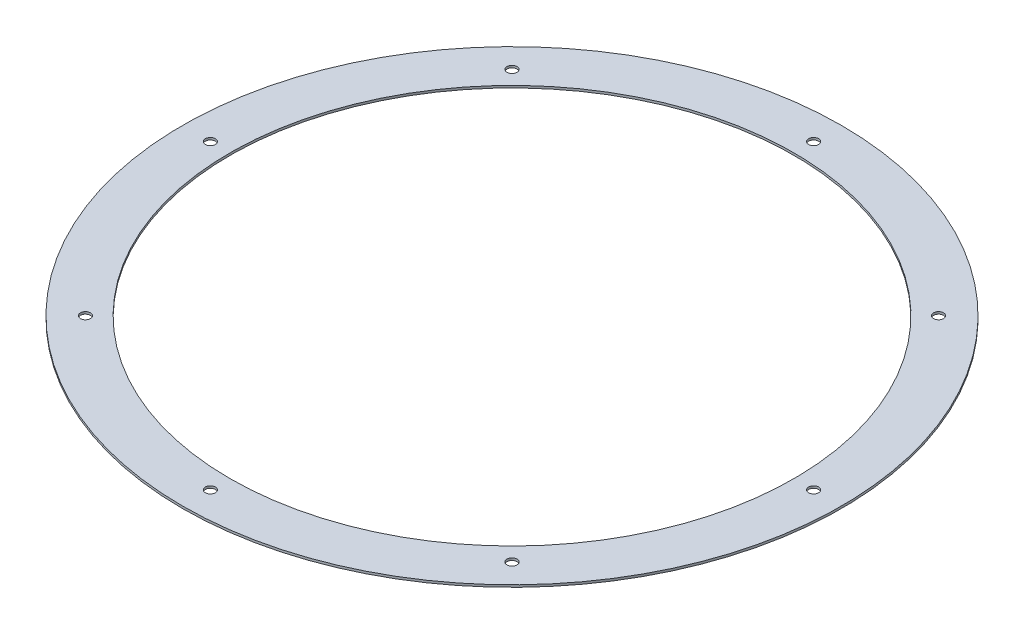
from build123d import *

# Parameters (mm, degrees)
SKETCH1_R           = 295
SKETCH1_R_2         = 252.5
BOSS_EXTRUDE1_DEPTH = 2
SKETCH2_R           = 4.5
CUT_EXTRUDE1_DEPTH  = 2
CIRPATTERN1_COUNT   = 8


with BuildPart() as part:
    # Sketch1 → Boss-Extrude1 (new body)
    with BuildSketch(Plane(origin=(0, 0, 0), x_dir=(1, 0, 0), z_dir=(0, 1, 0))):
        with Locations(Location((0, 0, 0), (0, 0, 270))):
            Circle(SKETCH1_R)
        with Locations(Location((0, 0, 0), (0, 0, 270))):
            Circle(SKETCH1_R_2, mode=Mode.SUBTRACT)
    extrude(amount=BOSS_EXTRUDE1_DEPTH)

    # Sketch2 → Cut-Extrude1 (cut)
    with BuildSketch(Plane(origin=(0, 2, 0), x_dir=(1, 0, 0), z_dir=(0, 1, 0))):
        with Locations(Location((0, 270, 0), (0, 0, 270))):
            Circle(SKETCH2_R)
    cut_extrude1 = extrude(amount=-CUT_EXTRUDE1_DEPTH, mode=Mode.SUBTRACT)

    # CirPattern1: Cut-Extrude1 ×8 about axis
    cirpattern1_axis = Axis((0, 0, 0), (0, 1, 0))
    for i in range(1, CIRPATTERN1_COUNT):
        add(cut_extrude1.rotate(cirpattern1_axis, i * 360 / CIRPATTERN1_COUNT), mode=Mode.SUBTRACT)


solid = part.part
